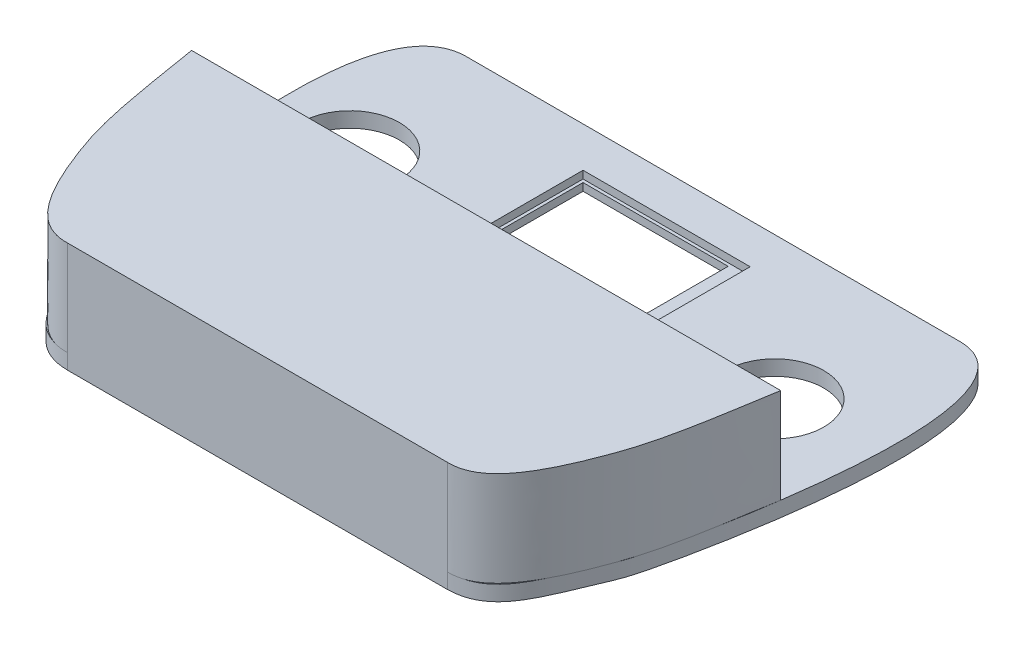
from build123d import *

# Parameters (mm, degrees)
BOSS_EXTRUDE1_DEPTH = 4
SKETCH3_R           = 13
SKETCH3_R_2         = 12.900313703
CUT_EXTRUDE2_DEPTH  = 101.11392848
SKETCH6_W           = 44
SKETCH6_H           = 34
CUT_EXTRUDE3_DEPTH  = 2
SKETCH8_W           = 38.2
SKETCH8_H           = 32.4
CUT_EXTRUDE5_DEPTH  = 101.053978808
BOSS_EXTRUDE2_DEPTH = 25


with BuildPart() as part:
    # Sketch1 → Boss-Extrude1 (new body)
    with BuildSketch(Plane(origin=(0, 0, 0), x_dir=(1, 0, 0), z_dir=(0, 1, 0))):
        with BuildLine():
            Line((-65, 59.764729109), (65, 59.764729109))
            add(Edge.make_bspline(
                [(65, 59.764729109), (88.687727136, 59.714491275), (73.42219291, -28.096601178), (64.179090334, -48.980552043), (61.151204198, -60.009930568), (50, -60.235270891)],
                knots=[0, 0, 0, 0, 0.225756085, 0.325756085, 1, 1, 1, 1], degree=3))
            Line((50, -60.235270891), (-50, -60.235270891))
            add(Edge.make_bspline(
                [(-65, 59.764729109), (-88.687727136, 59.714491275), (-73.42219291, -28.096601178), (-64.179090334, -48.980552043), (-61.151204198, -60.009930568), (-50, -60.235270891)],
                knots=[0, 0, 0, 0, 0.225756085, 0.325756085, 1, 1, 1, 1], degree=3))
        make_face()
    extrude(amount=BOSS_EXTRUDE1_DEPTH)

    # Sketch3 → Cut-Extrude2 (cut, through all)
    with BuildSketch(Plane(origin=(0, 0, 0), x_dir=(-1, 0, 0), z_dir=(0, -1, 0))):
        with Locations(Location((58.759229403, 22.914729109, 0), (0, 0, 90))):
            Circle(SKETCH3_R)
        with Locations(Location((-53.645665468, 22.339729109, 0), (0, 0, 90))):
            Circle(SKETCH3_R_2)
    extrude(amount=-CUT_EXTRUDE2_DEPTH, mode=Mode.SUBTRACT)

    # Sketch6 → Cut-Extrude3 (cut)
    with BuildSketch(Plane(origin=(0, 4, 0), x_dir=(-1, 0, 0), z_dir=(0, -1, 0))):
        with Locations((1.7, 32.204729109)):
            Rectangle(SKETCH6_W, SKETCH6_H)
    extrude(amount=CUT_EXTRUDE3_DEPTH, mode=Mode.SUBTRACT)

    # Sketch8 → Cut-Extrude5 (cut, through all)
    with BuildSketch(Plane(origin=(0, 2, 0), x_dir=(1, 0, 0), z_dir=(0, 1, 0))):
        with Locations((-3.8, 32.204729109)):
            Rectangle(SKETCH8_W, SKETCH8_H)
    extrude(amount=-CUT_EXTRUDE5_DEPTH, mode=Mode.SUBTRACT)

    # Sketch10 → Boss-Extrude2 (add)
    with BuildSketch(Plane(origin=(0, 4, 0), x_dir=(1, 0, 0), z_dir=(0, 1, 0))):
        with BuildLine():
            Line((-50, -60.235270891), (50, -60.235270891))
            add(Edge.make_bspline(
                [(77.539616677, 0), (76.411660362, -6.469994077), (73.861455454, -24.631415856), (64.138708574, -53.213722082), (57.430311509, -60.426507103), (50, -60.235270891)],
                knots=[0, 0, 0, 0, 0.260173637, 0.360173637, 1, 1, 1, 1], degree=3))
            Line((77.539616677, 0), (-77.539616677, 0))
            add(Edge.make_bspline(
                [(-77.539616677, 0), (-76.411660362, -6.469994077), (-73.861455454, -24.631415856), (-64.138708574, -53.213722082), (-57.430311509, -60.426507103), (-50, -60.235270891)],
                knots=[0, 0, 0, 0, 0.260173637, 0.360173637, 1, 1, 1, 1], degree=3))
        make_face()
    extrude(amount=BOSS_EXTRUDE2_DEPTH)


solid = part.part
